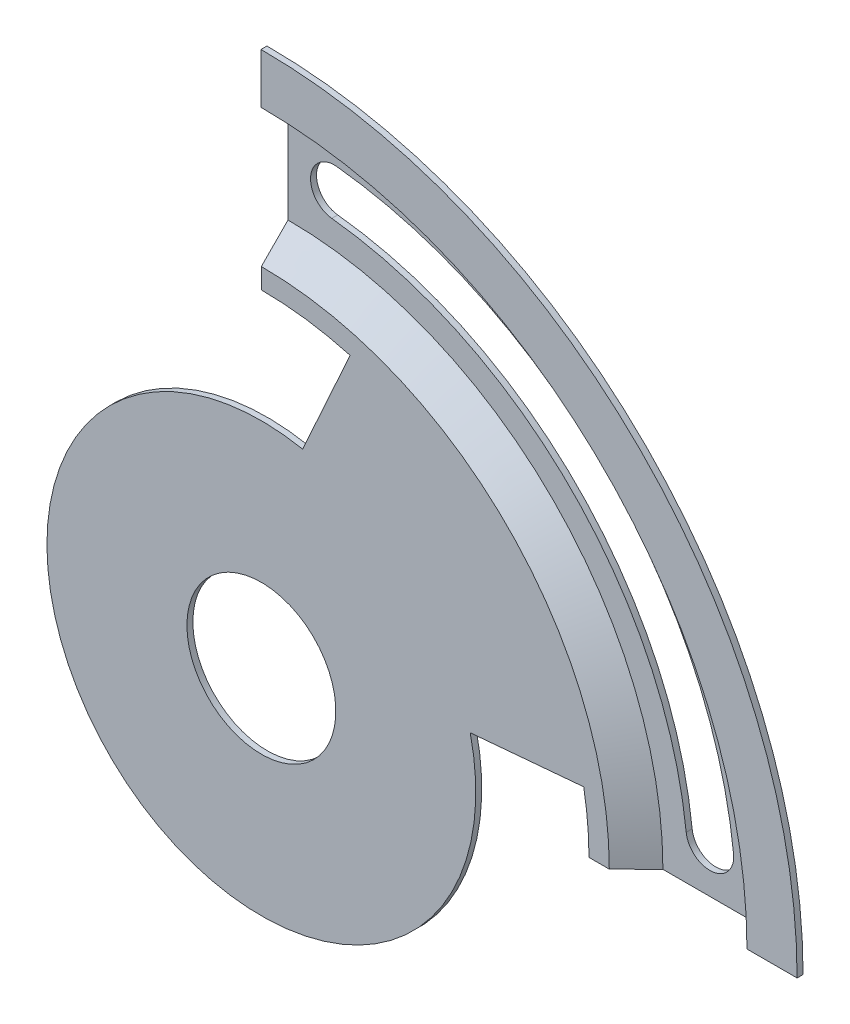
from build123d import *

# Parameters (mm, degrees)
REVOLVE1_ANGLE          = 90
BOSS_EXTRUDE1_START     = -1
SKETCH2_R               = 12.5
BOSS_EXTRUDE1_DEPTH     = 1
CUT_EXTRUDE1_DEPTH      = 143.444465377
CUT_EXTRUDE1_DEPTH_BACK = 143.444465377


with BuildPart() as part:
    # Sketch1 → Revolve1 (revolve)
    with BuildSketch(Plane(origin=(0, 0, 0), x_dir=(1, 0, 0), z_dir=(0, 1, 0))):
        Polygon((-16.271625609, -17.706954757), (-19.271625609, -17.706954757), (-19.271625609, -18.706954757), (-15.861337675, -18.706954757), (-11.331165057, -14.237179487), (2.840396891, -14.237179487), (7.310172161, -18.767352105), (15.728322279, -18.767352105), (15.728322279, -17.767352105), (7.728322279, -17.767352105), (3.258547009, -13.237179487), (-11.741452991, -13.237179487), align=None)
    revolve(axis=Axis((-74.271677721, 0, 17.706954757), (0, 0, 1)), revolution_arc=REVOLVE1_ANGLE)

    # Sketch2 → Boss-Extrude1 (add)
    with BuildSketch(Plane(origin=(0, 0, 17.706954757), x_dir=(-1, 0, 0), z_dir=(0, 0, -1)).offset(BOSS_EXTRUDE1_START)):
        with BuildLine():
            Line((67.342979074, 35.326946302), (59.371742963, 52.943344025))
            ThreePointArc((59.371742963, 52.943344025), (33.582268097, 37.005103388), (20.15595474, 9.823149116))
            Line((20.15595474, 9.823149116), (39.208104561, 8.157563191))
            ThreePointArc((39.208104561, 8.157563191), (99.279307908, -25.89630152), (67.342979074, 35.326946302))
        make_face()
        with Locations((74.271677721, 0)):
            Circle(SKETCH2_R, mode=Mode.SUBTRACT)
    extrude(amount=BOSS_EXTRUDE1_DEPTH)

    # Sketch3 → Cut-Extrude1 (cut, two sides: drawn at the far end of the back side and taken through both)
    with BuildSketch(Plane(origin=(0, 0, 13.237179487), x_dir=(-1, 0, 0), z_dir=(0, 0, -1)).offset(-CUT_EXTRUDE1_DEPTH_BACK)):
        with BuildLine():
            ThreePointArc((7.421193768, 7.350328837), (3.090443615, 3.801635214), (-0.54921214, 8.056224419))
            ThreePointArc((-0.54921214, 8.056224419), (21.059515993, 53.212161728), (66.215453303, 74.820889862))
            ThreePointArc((66.215453303, 74.820889862), (70.470042507, 71.181234106), (66.921348884, 66.850483953))
            ThreePointArc((66.921348884, 66.850483953), (26.716370243, 47.555307479), (7.421193768, 7.350328837))
        make_face()
    extrude(amount=CUT_EXTRUDE1_DEPTH + CUT_EXTRUDE1_DEPTH_BACK, mode=Mode.SUBTRACT)


solid = part.part
